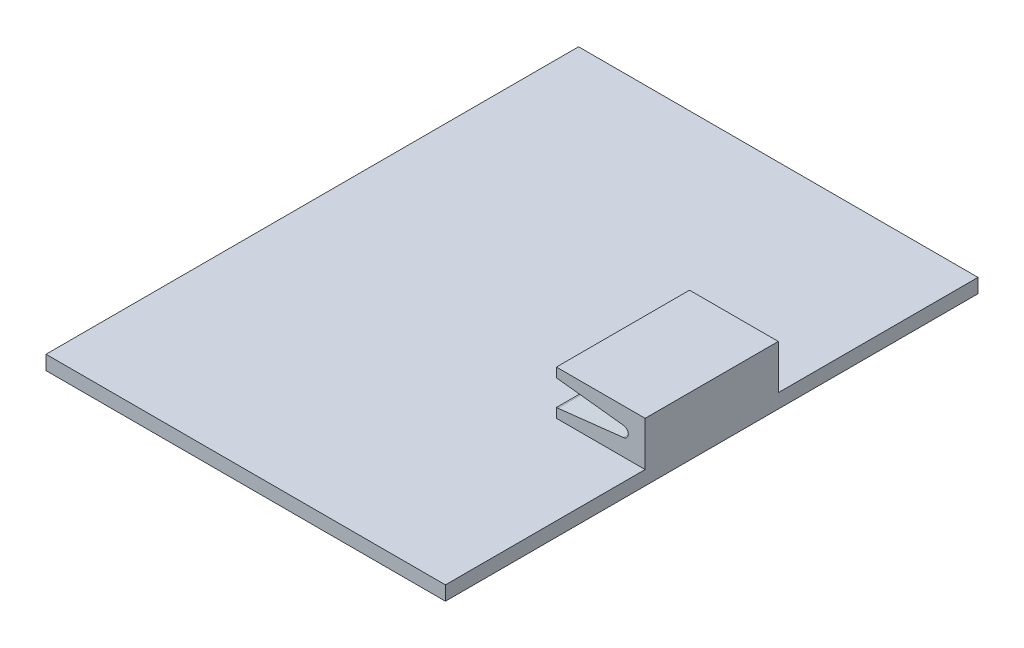
from build123d import *

# Parameters (mm, degrees)
SKETCH1_W               = 450
SKETCH1_H               = 600
BOSS_EXTRUDE1_DEPTH     = 16
SKETCH2_W               = 100
SKETCH2_H               = 150
BOSS_EXTRUDE2_DEPTH     = 50
CUT_EXTRUDE1_DEPTH      = 443.273670932
CUT_EXTRUDE1_DEPTH_BACK = 443.273670932


with BuildPart() as part:
    # Sketch1 → Boss-Extrude1 (new body)
    with BuildSketch(Plane(origin=(0, 0, 0), x_dir=(1, 0, 0), z_dir=(0, 1, 0))):
        Rectangle(SKETCH1_W, SKETCH1_H)
    extrude(amount=BOSS_EXTRUDE1_DEPTH)

    # Sketch2 → Boss-Extrude2 (add)
    with BuildSketch(Plane(origin=(0, 16, 0), x_dir=(1, 0, 0), z_dir=(0, 1, 0))):
        with Locations((175, 0)):
            Rectangle(SKETCH2_W, SKETCH2_H)
    extrude(amount=BOSS_EXTRUDE2_DEPTH)

    # Sketch3 → Cut-Extrude1 (cut, two sides: drawn at the far end of the back side and taken through both)
    with BuildSketch(Plane(origin=(0, 0, -75), x_dir=(-1, 0, 0), z_dir=(0, 0, -1)).offset(-CUT_EXTRUDE1_DEPTH_BACK)):
        with BuildLine():
            Line((-200.674344807, 46.961984492), (-126.621721722, 55.337887164))
            ThreePointArc((-126.621721722, 55.337887164), (-110.57068991, 41), (-126.621721722, 26.662112836))
            Line((-126.621721722, 26.662112836), (-200.674344807, 35.038015508))
            ThreePointArc((-200.674344807, 35.038015508), (-206, 41), (-200.674344807, 46.961984492))
        make_face()
    extrude(amount=CUT_EXTRUDE1_DEPTH + CUT_EXTRUDE1_DEPTH_BACK, mode=Mode.SUBTRACT)


solid = part.part
